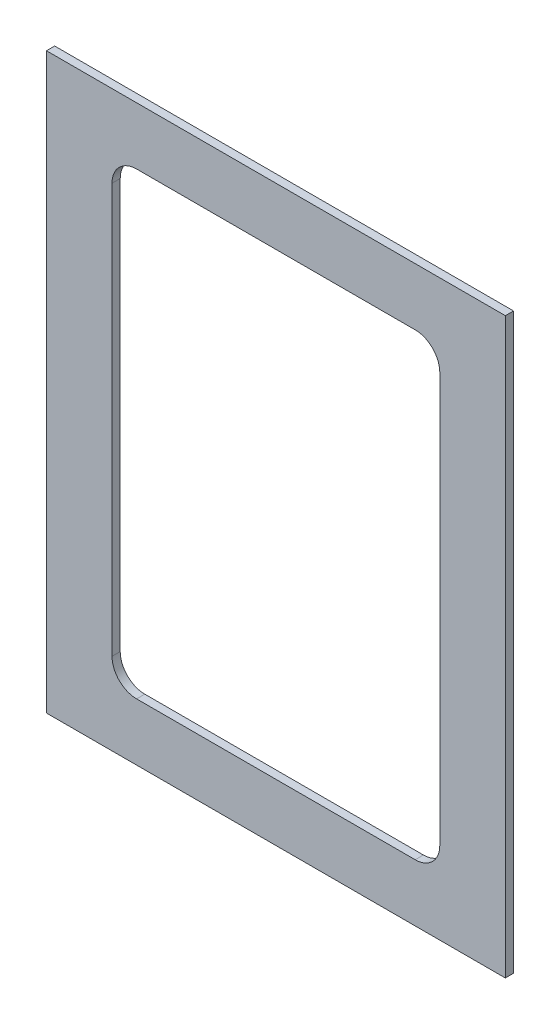
from build123d import *

# Parameters (mm, degrees)
SKETCH1_W           = 177.8
SKETCH1_H           = 222.25
BOSS_EXTRUDE1_DEPTH = 3.175
CUT_EXTRUDE1_DEPTH  = 240.391631276


with BuildPart() as part:
    # Sketch1 → Boss-Extrude1 (new body)
    with BuildSketch(Plane.XY):
        with Locations((0, 111.125)):
            Rectangle(SKETCH1_W, SKETCH1_H)
    extrude(amount=BOSS_EXTRUDE1_DEPTH)

    # Sketch2 → Cut-Extrude1 (cut, through all)
    with BuildSketch(Plane.XY.offset(3.175)):
        with BuildLine():
            Line((53.975, 22.225), (-53.975, 22.225))
            ThreePointArc((-53.975, 22.225), (-60.710192091, 25.014807909), (-63.5, 31.75))
            Line((-63.5, 31.75), (-63.5, 190.5))
            ThreePointArc((-63.5, 190.5), (-60.710192091, 197.235192091), (-53.975, 200.025))
            Line((-53.975, 200.025), (53.975, 200.025))
            ThreePointArc((53.975, 200.025), (60.710192091, 197.235192091), (63.5, 190.5))
            Line((63.5, 190.5), (63.5, 31.75))
            ThreePointArc((63.5, 31.75), (60.710192091, 25.014807909), (53.975, 22.225))
        make_face()
    extrude(amount=-CUT_EXTRUDE1_DEPTH, mode=Mode.SUBTRACT)


solid = part.part
